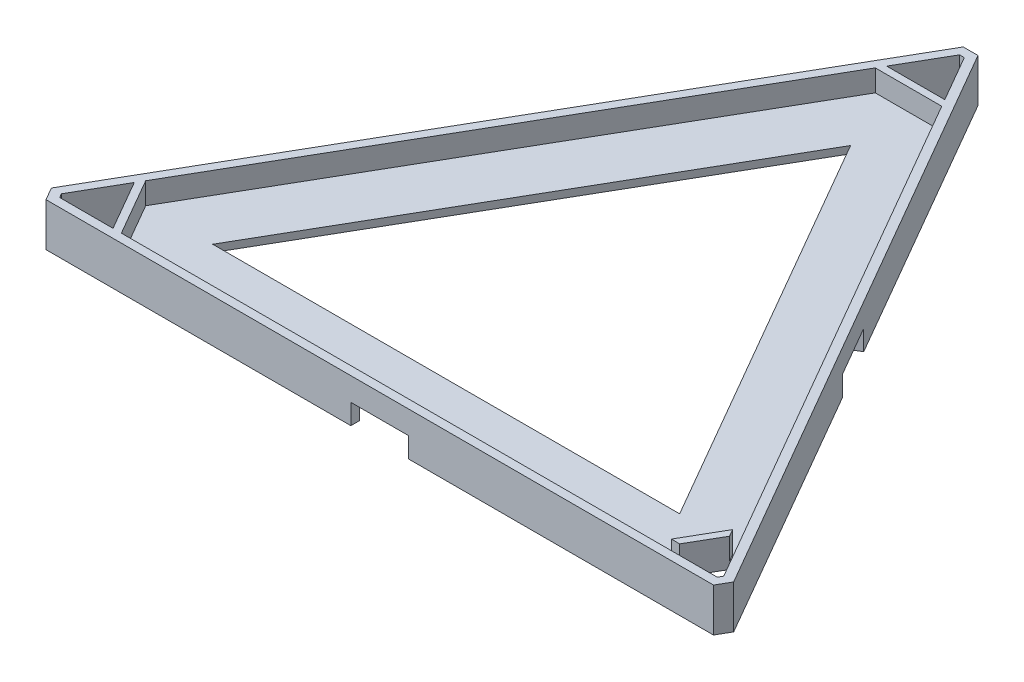
from build123d import *

# Parameters (mm, degrees)
BOSS_EXTRUDE1_DEPTH      = 2.5
BOSS_EXTRUDE2_DEPTH      = 10
BOSS_EXTRUDE3_DEPTH      = 10
BOSS_EXTRUDE3_DEPTH_BACK = 5
SKETCH3_W                = 20
SKETCH3_H                = 14
CUT_EXTRUDE3_DEPTH       = 20
SKETCH5_W                = 20
SKETCH5_H                = 14
CUT_EXTRUDE4_DEPTH       = 20
SKETCH6_W                = 20
SKETCH6_H                = 14
CUT_EXTRUDE5_DEPTH       = 20


with BuildPart() as part:
    # Sketch1 → Boss-Extrude1 (new body)
    with BuildSketch(Plane(origin=(0, 0, 0), x_dir=(1, 0, 0), z_dir=(0, 1, 0))):
        Polygon((243.304219773, -116.484791866), (254.809280576, -136.408896139), (442.602090749, -136.409305398), (444.621046679, -132.925433223), (441.749040748, -132.925433223), (449.516726723, -119.471406457), (450.964695297, -121.978953122), (452.699916621, -118.984688017), (358.778179035, 43.666038066), (335.767496284, 43.666038066), align=None)
        Polygon((428.113670919, -116.417164681), (266.439108268, -116.428009241), (347.273609729, 23.609230825), align=None, mode=Mode.SUBTRACT)
    extrude(amount=BOSS_EXTRUDE1_DEPTH)

    # Sketch1<9> → Boss-Extrude2 (add)
    # profile 1 of 2: a face of its own
    with BuildSketch(Plane(origin=(0, 0, 0), x_dir=(1, 0, 0), z_dir=(0, 1, 0))):
        Polygon((229.159432547, -134.984249184), (231.716666588, -139.412373829), (462.829865412, -139.412373829), (465.38624875, -134.984588004), (349.829542096, 65.165499075), (344.716133219, 65.165499075), align=None)
        Polygon((251.922647988, -136.4093054), (233.446303399, -136.408896139), (232.623553959, -134.984217358), (241.860901688, -118.984688019), align=None, mode=Mode.SUBTRACT)
        Polygon((442.602090749, -136.409305398), (254.809280576, -136.408896139), (243.304219773, -116.484791866), (335.767496284, 43.666038066), (358.778179035, 43.666038066), (461.938967957, -134.984588004), (461.116393748, -136.409305398), align=None, mode=Mode.SUBTRACT)
        Polygon((348.096628302, 62.164013367), (357.334800991, 46.166038067), (337.210874326, 46.166038067), (346.44844193, 62.165948237), align=None, mode=Mode.SUBTRACT)
    # profile 2 of 2: a face of its own
    with BuildSketch(Plane(origin=(0, 0, 0), x_dir=(1, 0, 0), z_dir=(0, 1, 0))):
        Polygon((441.749040748, -132.925433223), (444.621046679, -132.925433223), (450.964695297, -121.978953122), (449.516726723, -119.471406457), align=None)
    extrude(amount=BOSS_EXTRUDE2_DEPTH)

    # Sketch1<10> → Boss-Extrude3 (add, two sides: drawn at the far end of the back side and taken through both)
    with BuildSketch(Plane(origin=(0, 0, 0), x_dir=(1, 0, 0), z_dir=(0, 1, 0)).offset(-BOSS_EXTRUDE3_DEPTH_BACK)):
        Polygon((229.159432547, -134.984249184), (231.716666588, -139.412373829), (462.829865412, -139.412373829), (465.38624875, -134.984588004), (349.829542096, 65.165499075), (344.716133219, 65.165499075), align=None)
        Polygon((251.922647988, -136.4093054), (233.446303399, -136.408896139), (232.623553959, -134.984217358), (241.860901688, -118.984688019), align=None, mode=Mode.SUBTRACT)
        Polygon((442.602090749, -136.409305398), (254.809280576, -136.408896139), (243.304219773, -116.484791866), (335.767496284, 43.666038066), (358.778179035, 43.666038066), (452.699916621, -118.984688017), (461.938967957, -134.984588004), (461.116393748, -136.409305398), align=None, mode=Mode.SUBTRACT)
        Polygon((348.096628302, 62.164013367), (357.334800991, 46.166038067), (337.210874326, 46.166038067), (346.44844193, 62.165948237), align=None, mode=Mode.SUBTRACT)
    extrude(amount=BOSS_EXTRUDE3_DEPTH + BOSS_EXTRUDE3_DEPTH_BACK)

    # Sketch3 → Cut-Extrude3 (cut)
    with BuildSketch(Plane(origin=(290.589645397, 0, -167.772009994), x_dir=(-0.49999999999998745, 0, -0.8660254037844459), z_dir=(0.8660254037844459, 0, -0.49999999999998745))):
        with Locations((-236.592990632, -5)):
            Rectangle(SKETCH3_W, SKETCH3_H)
    extrude(amount=-CUT_EXTRUDE3_DEPTH, mode=Mode.SUBTRACT)

    # Sketch5 → Cut-Extrude4 (cut)
    with BuildSketch(Plane.XY.offset(139.412373829)):
        with Locations((347.273266, -5)):
            Rectangle(SKETCH5_W, SKETCH5_H)
    extrude(amount=-CUT_EXTRUDE4_DEPTH, mode=Mode.SUBTRACT)

    # Sketch6 → Cut-Extrude5 (cut)
    with BuildSketch(Plane(origin=(230.319375797, 0, 132.975171838), x_dir=(-0.5000006154012504, 0, 0.8660250484820695), z_dir=(-0.8660250484820695, 0, -0.5000006154012504))):
        with Locations((-113.2366748, -5)):
            Rectangle(SKETCH6_W, SKETCH6_H)
    extrude(amount=-CUT_EXTRUDE5_DEPTH, mode=Mode.SUBTRACT)


solid = part.part
